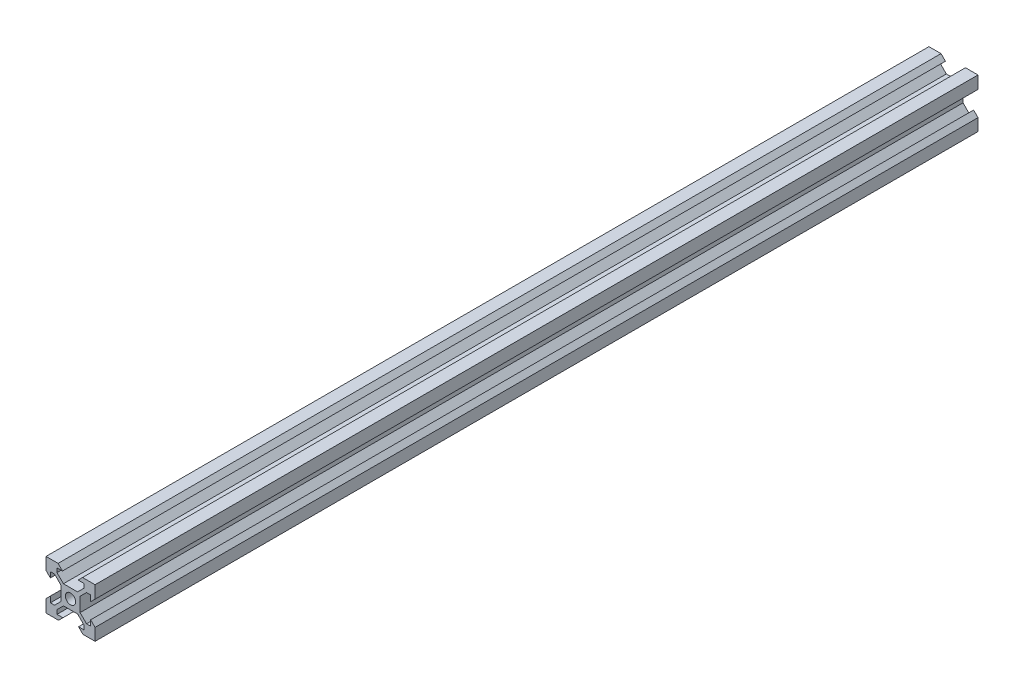
from build123d import *

# Parameters (mm, degrees)
SKETCH1_R           = 2.1
BOSS_EXTRUDE1_DEPTH = 360


with BuildPart() as part:
    # Sketch1 (on Front Plane) → Boss-Extrude1 (new body)
    with BuildSketch(Plane.XY):
        Polygon((-5.074586208, 10), (-3.28215401, 8.207567802), (-5.525872647, 8.207567802), (-5.525872647, 6.527957213), (-2.897129144, 3.89921371), (2.868055105, 3.89921371), (5.496798608, 6.527957213), (5.496798608, 8.207567802), (3.093698324, 8.207567802), (4.886130522, 10), (10, 10), (10, 4.886130522), (8.207567802, 3.093698324), (8.207567802, 5.496798608), (6.527957213, 5.496798608), (3.89921371, 2.868055105), (3.89921371, -2.897129144), (6.527957213, -5.525872647), (8.207567802, -5.525872647), (8.207567802, -3.28215401), (10, -5.074586208), (10, -10), (5.074586208, -10), (3.28215401, -8.207567802), (5.525872647, -8.207567802), (5.525872647, -6.527957213), (2.897129144, -3.89921371), (-2.868055105, -3.89921371), (-5.496798608, -6.527957213), (-5.496798608, -8.207567802), (-3.093698324, -8.207567802), (-4.886130522, -10), (-10, -10), (-10, -4.886130522), (-8.207567802, -3.093698324), (-8.207567802, -5.496798608), (-6.527957213, -5.496798608), (-3.89921371, -2.868055105), (-3.89921371, 2.897129144), (-6.527957213, 5.525872647), (-8.207567802, 5.525872647), (-8.207567802, 3.28215401), (-10, 5.074586208), (-10, 10), align=None)
        with Locations(Location((0, 0, 0), (0, 0, 180))):
            Circle(SKETCH1_R, mode=Mode.SUBTRACT)
    extrude(amount=BOSS_EXTRUDE1_DEPTH)


solid = part.part
